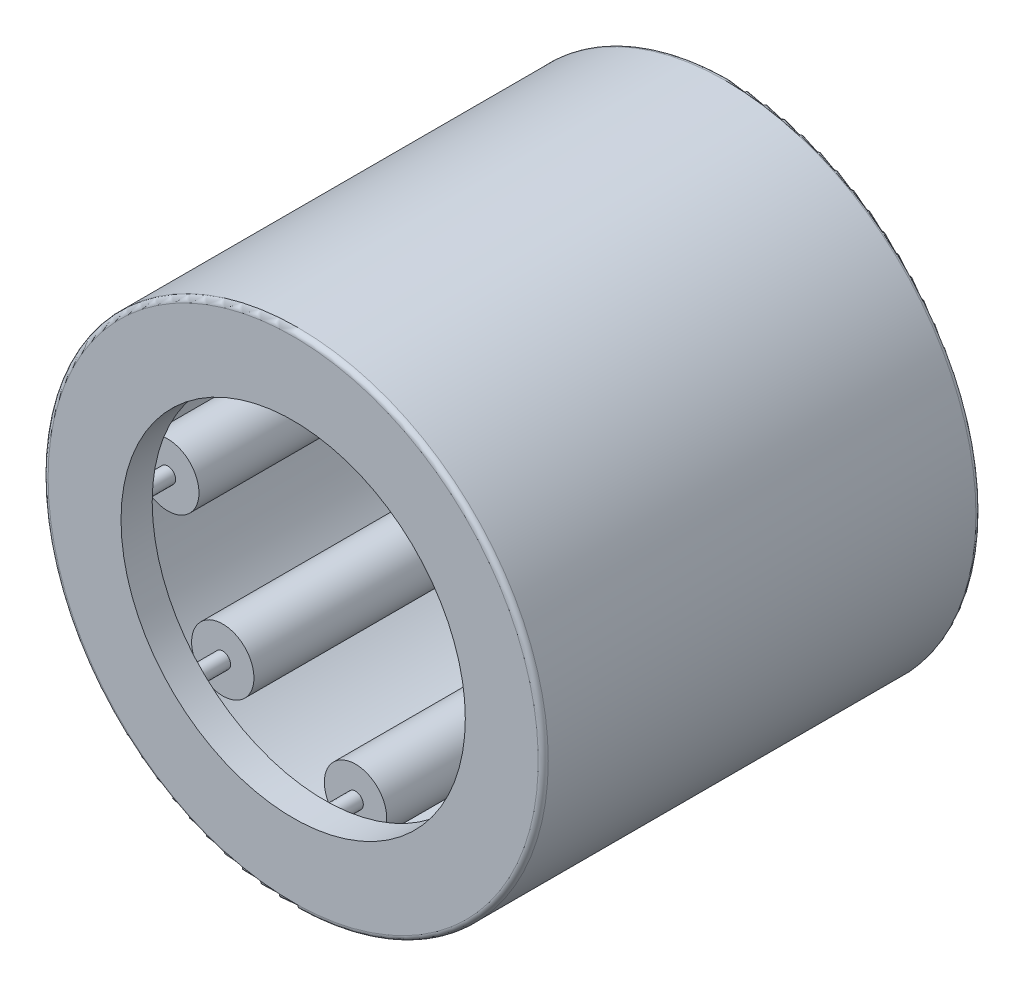
from build123d import *

# Parameters (mm, degrees)
SKETCH2_W         = 7.945966666
SKETCH2_H         = 0.593725
SKETCH3_W         = 9.529233334
SKETCH3_H         = 0.197908334
CIRPATTERN1_COUNT = 8
CIRPATTERN1_ANGLE = 315
FILLET1_R         = 0.127


with BuildPart() as part:
    # Sketch1 → Revolve1 (revolve)
    with BuildSketch(Plane(origin=(0, 0, 0), x_dir=(0, 0, -1), z_dir=(1, 0, 0)), mode=Mode.PRIVATE) as revolve1_sk:
        Polygon((-5.55625, 6.35), (5.55625, 6.35), (5.55625, 4.370916667), (4.764616667, 4.370916667), (4.764616667, 5.558366667), (-4.764616667, 5.558366667), (-4.764616667, 4.370916667), (-5.55625, 4.370916667), align=None)
    revolve(revolve1_sk.sketch.rotate(Axis((0, 0, 5.55625), (0, 0, -1)), 90), axis=Axis((0, 0, 5.55625), (0, 0, -1)))

    # Fillet1
    fillet1_edges = [part.edges().sort_by_distance(p)[0] for p in [
        (-6.35, 0, 5.55625),
        (-6.35, 0, -5.55625),
    ]]
    fillet(fillet1_edges, radius=FILLET1_R)


with BuildPart() as body_2:
    # Sketch2 → Revolve2 (revolve)
    with BuildSketch(Plane(origin=(0, 0, 0), x_dir=(0, 0, -1), z_dir=(1, 0, 0)), mode=Mode.PRIVATE) as revolve2_sk:
        with Locations((0, 5.261504167)):
            Rectangle(SKETCH2_W, SKETCH2_H)
    revolve(revolve2_sk.sketch.rotate(Axis((0, 4.766733333, 3.972983333), (0, 0, -1)), 180), axis=Axis((0, 4.766733333, 3.972983333), (0, 0, -1)))


with BuildPart() as body_3:
    # Sketch3 → Revolve3 (revolve)
    with BuildSketch(Plane(origin=(0, 0, 0), x_dir=(0, 0, -1), z_dir=(1, 0, 0)), mode=Mode.PRIVATE) as revolve3_sk:
        with Locations((0, 4.8656875)):
            Rectangle(SKETCH3_W, SKETCH3_H)
    revolve(revolve3_sk.sketch.rotate(Axis((0, 4.766733333, 4.764616667), (0, 0, -1)), 90), axis=Axis((0, 4.766733333, 4.764616667), (0, 0, -1)))


with BuildPart() as cirpattern1_1:
    # CirPattern1: pattern copy
    add(body_2.part.rotate(Axis((0, 0, -5.55625), (0, 0, 1)), 1 * CIRPATTERN1_ANGLE / (CIRPATTERN1_COUNT - 1)))


with BuildPart() as cirpattern1_2:
    # CirPattern1: pattern copy
    add(body_2.part.rotate(Axis((0, 0, -5.55625), (0, 0, 1)), 2 * CIRPATTERN1_ANGLE / (CIRPATTERN1_COUNT - 1)))


with BuildPart() as cirpattern1_3:
    # CirPattern1: pattern copy
    add(body_2.part.rotate(Axis((0, 0, -5.55625), (0, 0, 1)), 3 * CIRPATTERN1_ANGLE / (CIRPATTERN1_COUNT - 1)))


with BuildPart() as cirpattern1_4:
    # CirPattern1: pattern copy
    add(body_2.part.rotate(Axis((0, 0, -5.55625), (0, 0, 1)), 4 * CIRPATTERN1_ANGLE / (CIRPATTERN1_COUNT - 1)))


with BuildPart() as cirpattern1_5:
    # CirPattern1: pattern copy
    add(body_2.part.rotate(Axis((0, 0, -5.55625), (0, 0, 1)), 5 * CIRPATTERN1_ANGLE / (CIRPATTERN1_COUNT - 1)))


with BuildPart() as cirpattern1_6:
    # CirPattern1: pattern copy
    add(body_2.part.rotate(Axis((0, 0, -5.55625), (0, 0, 1)), 6 * CIRPATTERN1_ANGLE / (CIRPATTERN1_COUNT - 1)))


with BuildPart() as cirpattern1_7:
    # CirPattern1: pattern copy
    add(body_2.part.rotate(Axis((0, 0, -5.55625), (0, 0, 1)), 7 * CIRPATTERN1_ANGLE / (CIRPATTERN1_COUNT - 1)))


with BuildPart() as cirpattern1_8:
    # CirPattern1: pattern copy
    add(body_3.part.rotate(Axis((0, 0, -5.55625), (0, 0, 1)), 1 * CIRPATTERN1_ANGLE / (CIRPATTERN1_COUNT - 1)))


with BuildPart() as cirpattern1_9:
    # CirPattern1: pattern copy
    add(body_3.part.rotate(Axis((0, 0, -5.55625), (0, 0, 1)), 2 * CIRPATTERN1_ANGLE / (CIRPATTERN1_COUNT - 1)))


with BuildPart() as cirpattern1_10:
    # CirPattern1: pattern copy
    add(body_3.part.rotate(Axis((0, 0, -5.55625), (0, 0, 1)), 3 * CIRPATTERN1_ANGLE / (CIRPATTERN1_COUNT - 1)))


with BuildPart() as cirpattern1_11:
    # CirPattern1: pattern copy
    add(body_3.part.rotate(Axis((0, 0, -5.55625), (0, 0, 1)), 4 * CIRPATTERN1_ANGLE / (CIRPATTERN1_COUNT - 1)))


with BuildPart() as cirpattern1_12:
    # CirPattern1: pattern copy
    add(body_3.part.rotate(Axis((0, 0, -5.55625), (0, 0, 1)), 5 * CIRPATTERN1_ANGLE / (CIRPATTERN1_COUNT - 1)))


with BuildPart() as cirpattern1_13:
    # CirPattern1: pattern copy
    add(body_3.part.rotate(Axis((0, 0, -5.55625), (0, 0, 1)), 6 * CIRPATTERN1_ANGLE / (CIRPATTERN1_COUNT - 1)))


with BuildPart() as cirpattern1_14:
    # CirPattern1: pattern copy
    add(body_3.part.rotate(Axis((0, 0, -5.55625), (0, 0, 1)), 7 * CIRPATTERN1_ANGLE / (CIRPATTERN1_COUNT - 1)))


solid = Compound([part.part, body_2.part, body_3.part, cirpattern1_1.part, cirpattern1_2.part, cirpattern1_3.part, cirpattern1_4.part, cirpattern1_5.part, cirpattern1_6.part, cirpattern1_7.part, cirpattern1_8.part, cirpattern1_9.part, cirpattern1_10.part, cirpattern1_11.part, cirpattern1_12.part, cirpattern1_13.part, cirpattern1_14.part])
